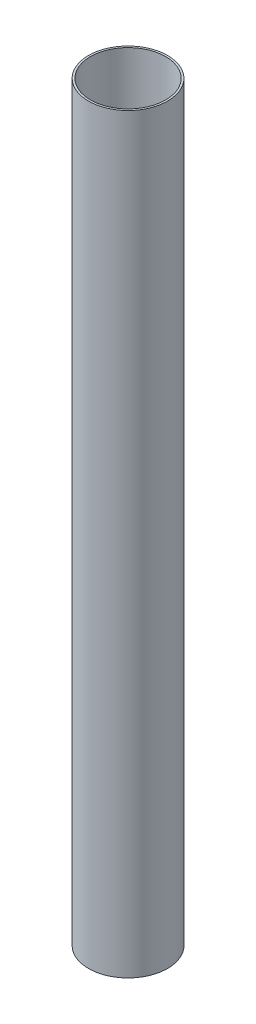
from build123d import *

# Parameters (mm, degrees)
SKETCH1_R   = 25.4
SKETCH1_R_2 = 24.1554
BODY_DEPTH  = 482.6


with BuildPart() as part:
    # Sketch1 → body (new body)
    with BuildSketch(Plane(origin=(0, 0, 0), x_dir=(1, 0, 0), z_dir=(0, 1, 0))):
        with Locations(Location((0, 0, 0), (0, 0, 90))):
            Circle(SKETCH1_R)
        with Locations(Location((0, 0, 0), (0, 0, 90))):
            Circle(SKETCH1_R_2, mode=Mode.SUBTRACT)
    extrude(amount=BODY_DEPTH)


solid = part.part
